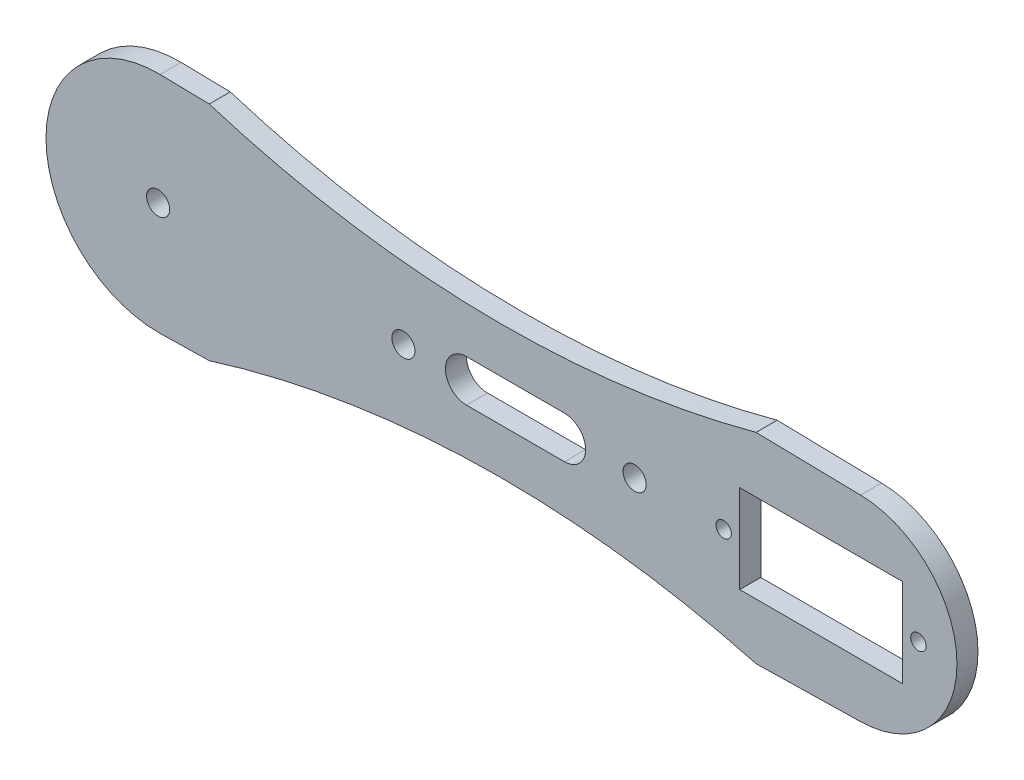
from build123d import *

# Parameters (mm, degrees)
ESKIZ_KONTUR_W        = 23.2
ESKIZ_KONTUR_H        = 12.6
PLASTINA_DEPTH        = 3
OTVERSTIYA_DEPTH      = 116.156318141
OTVERSTIYA_DEPTH_BACK = 116.156318141
ESKIZ_OTVERSTIYA_R    = 1.65
ESKIZ_OTVERSTIYA_R_2  = 1.1


with BuildPart() as part:
    # Eskiz_kontur → Plastina (new body)
    with BuildSketch(Plane.XY):
        with BuildLine():
            Line((7.29115, -15.8573), (0.27924, -15.99756))
            ThreePointArc((0.27924, -15.99756), (-15.999996904, 0), (0.27924, 15.99756))
            Line((0.27924, 15.99756), (7.29115, 15.8573))
            ThreePointArc((7.29115, 15.8573), (46.200008227, 9.528004702), (85.330859965, 14.296198255))
            Line((85.330859965, 14.296198255), (100.244329965, 13.997868255))
            ThreePointArc((100.244329965, 13.997868255), (113.999902223, 0), (100.244329965, -13.997868255))
            Line((100.244329965, -13.997868255), (85.330859965, -14.296198255))
            ThreePointArc((85.330859965, -14.296198255), (46.200008227, -9.528004702), (7.29115, -15.8573))
        make_face()
        with BuildLine():
            Line((58, 3), (44, 3))
            ThreePointArc((44, 3), (41, 0), (44, -3))
            Line((44, -3), (58, -3))
            ThreePointArc((58, -3), (61, 0), (58, 3))
        make_face(mode=Mode.SUBTRACT)
        with Locations((94.6, 0)):
            Rectangle(ESKIZ_KONTUR_W, ESKIZ_KONTUR_H, mode=Mode.SUBTRACT)
    extrude(amount=PLASTINA_DEPTH)

    # Eskiz_otverstiya → Otverstiya (cut, two sides: drawn at the far end of the back side and taken through both)
    with BuildSketch(Plane.XY.offset(-OTVERSTIYA_DEPTH_BACK)):
        Circle(ESKIZ_OTVERSTIYA_R)
        with Locations((35, 0)):
            Circle(ESKIZ_OTVERSTIYA_R)
        with Locations((68, 0)):
            Circle(ESKIZ_OTVERSTIYA_R)
        with Locations((80.7, 0)):
            Circle(ESKIZ_OTVERSTIYA_R_2)
        with Locations((108.5, 0)):
            Circle(ESKIZ_OTVERSTIYA_R_2)
    extrude(amount=OTVERSTIYA_DEPTH + OTVERSTIYA_DEPTH_BACK, mode=Mode.SUBTRACT)


solid = part.part
